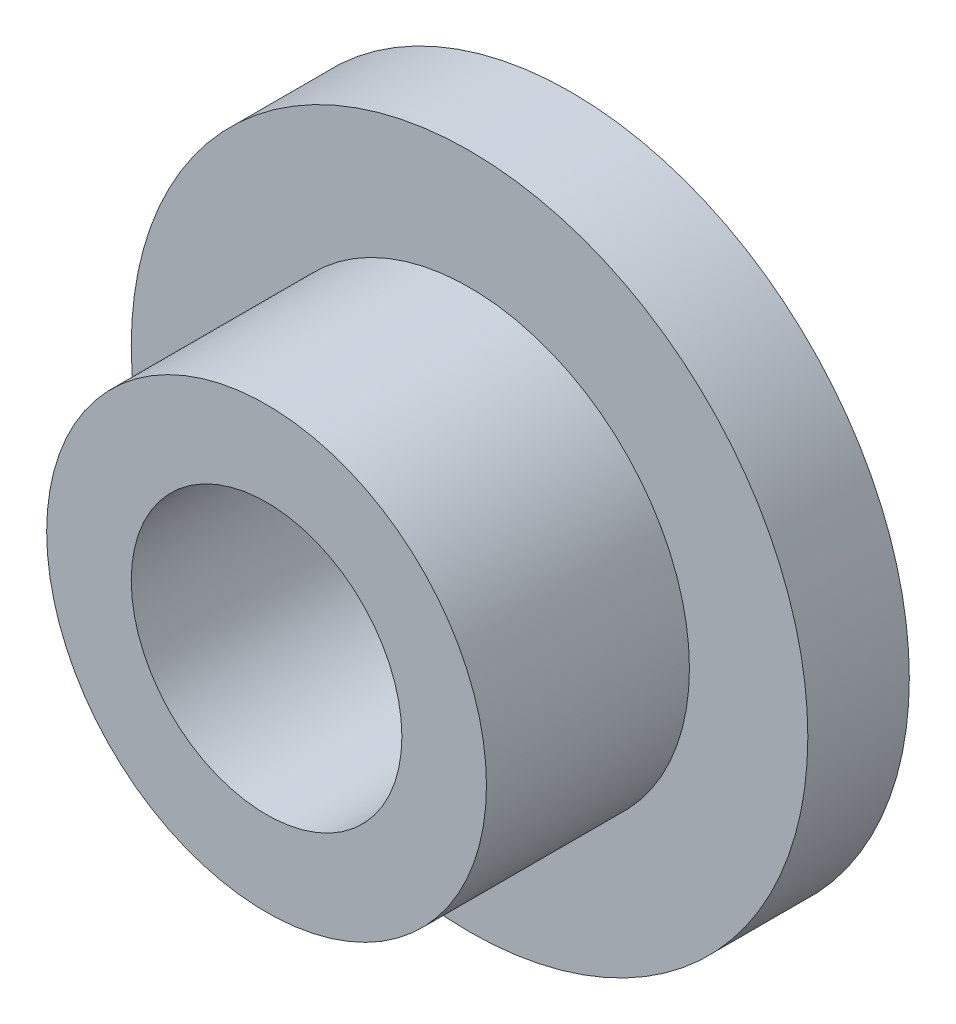
from build123d import *
from build123d.topology import SkipClean

# Parameters (mm, degrees)
SKETCH1_R           = 1.3
SKETCH1_R_2         = 0.8
BOSS_EXTRUDE1_DEPTH = 1.2
BOSS_EXTRUDE2_START = 0.6
SKETCH2_R           = 2
SKETCH2_R_2         = 0.8
BOSS_EXTRUDE2_DEPTH = 0.6


with BuildPart() as part:
    # Sketch1 → Boss-Extrude1 (new body)
    with BuildSketch(Plane.XY):
        with Locations((-25.819173571, 38.976850261)):
            Circle(SKETCH1_R)
        with Locations((-25.819173571, 38.976850261)):
            Circle(SKETCH1_R_2, mode=Mode.SUBTRACT)
    extrude(amount=BOSS_EXTRUDE1_DEPTH)

    # Sketch2 → Boss-Extrude2 (add)
    with SkipClean():  # the faces are left unmerged after this step: merging them gives an invalid solid
        with BuildSketch(Plane(origin=(0, 0, 0), x_dir=(-1, 0, 0), z_dir=(0, 0, -1)).offset(BOSS_EXTRUDE2_START)):
            with Locations((25.819173571, 38.976850261)):
                Circle(SKETCH2_R)
            with Locations((25.819173571, 38.976850261)):
                Circle(SKETCH2_R_2, mode=Mode.SUBTRACT)
        extrude(amount=-BOSS_EXTRUDE2_DEPTH)


solid = part.part
